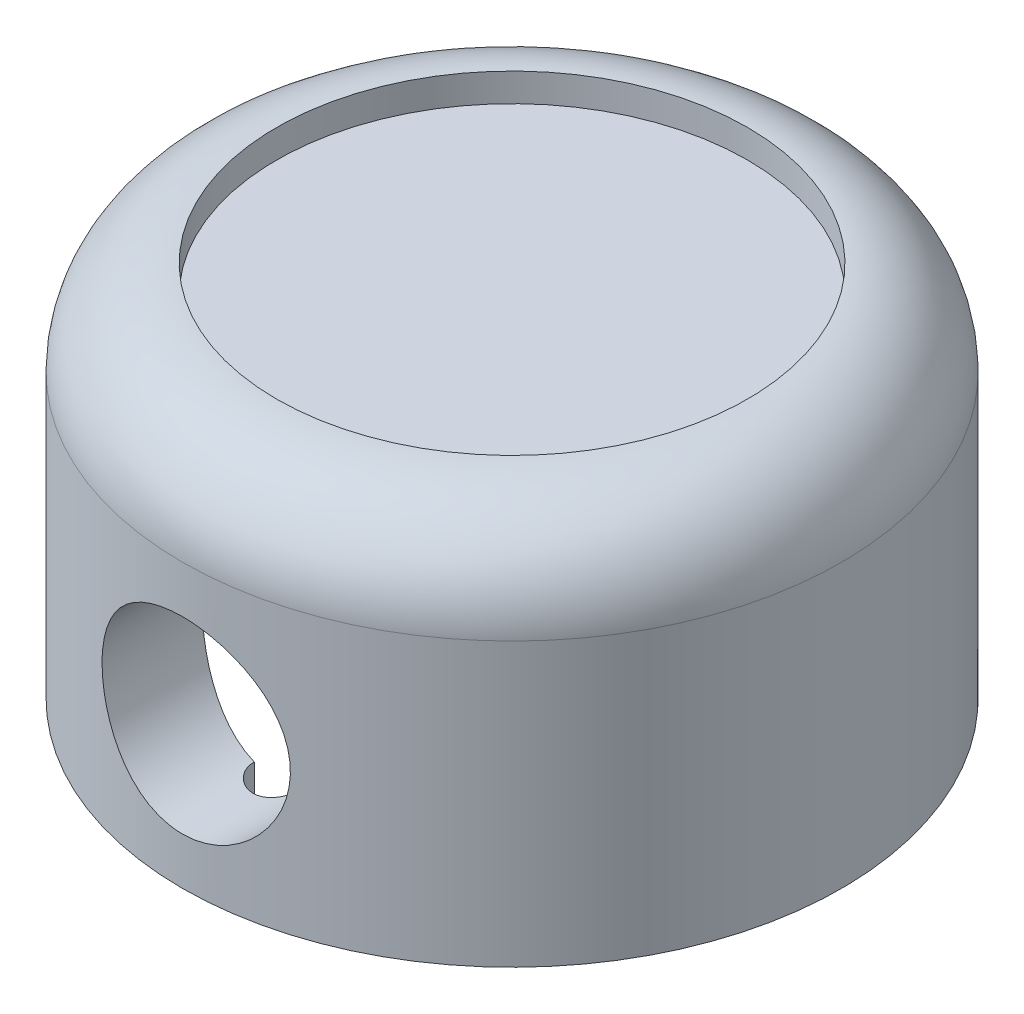
from build123d import *

# Parameters (mm, degrees)
ESQUISSE2_R             = 35
BOSS_EXTRU_1_DEPTH      = 40
CONG_1_R                = 10
ESQUISSE3_R             = 25
ENL_V_MAT_EXTRU_1_DEPTH = 30
ENL_V_START             = -3
ESQUISSE7_R             = 25
ENL_V_MAT_EXTRU_3_DEPTH = 3
ESQUISSE8_R             = 10
ENL_V_MAT_EXTRU_4_DEPTH = 45
ESQUISSE4_R             = 2.5
ENL_V_MAT_EXTRU_5_DEPTH = 30


with BuildPart() as part:
    # Esquisse2 → Boss.-Extru.1 (new body)
    with BuildSketch(Plane(origin=(0, 0, 0), x_dir=(1, 0, 0), z_dir=(0, 1, 0))):
        with Locations(Location((0, 0, 0), (0, 0, 270))):
            Circle(ESQUISSE2_R)
    extrude(amount=BOSS_EXTRU_1_DEPTH)

    # Congé1
    cong_1_edges = [part.edges().sort_by_distance(p)[0] for p in [
        (0, 40, -35),
    ]]
    fillet(cong_1_edges, radius=CONG_1_R)

    # Esquisse3 → Enlèv. mat.-Extru.1 (cut)
    with BuildSketch(Plane.XZ):
        with Locations(Location((0, 0, 0), (0, 0, 270))):
            Circle(ESQUISSE3_R)
    extrude(amount=-ENL_V_MAT_EXTRU_1_DEPTH, mode=Mode.SUBTRACT)

    # Esquisse7 → Enlèv. mat.-Extru.3 (cut)
    with BuildSketch(Plane(origin=(0, 40, 0), x_dir=(1, 0, 0), z_dir=(0, 1, 0)).offset(ENL_V_START)):
        with Locations(Location((0, 0, 0), (0, 0, 90))):
            Circle(ESQUISSE7_R)
    extrude(amount=ENL_V_MAT_EXTRU_3_DEPTH, mode=Mode.SUBTRACT)

    # Esquisse8 → Enlèv. mat.-Extru.4 (cut)
    with BuildSketch(Plane.XY):
        with Locations(Location((0, 15, 0), (0, 0, 180))):
            Circle(ESQUISSE8_R)
    extrude(amount=ENL_V_MAT_EXTRU_4_DEPTH, mode=Mode.SUBTRACT)

    # Esquisse4 → Enlèv. mat.-Extru.5 (cut)
    with BuildSketch(Plane.XZ):
        with Locations((0, 25)):
            Circle(ESQUISSE4_R)
    extrude(amount=-ENL_V_MAT_EXTRU_5_DEPTH, mode=Mode.SUBTRACT)


solid = part.part
